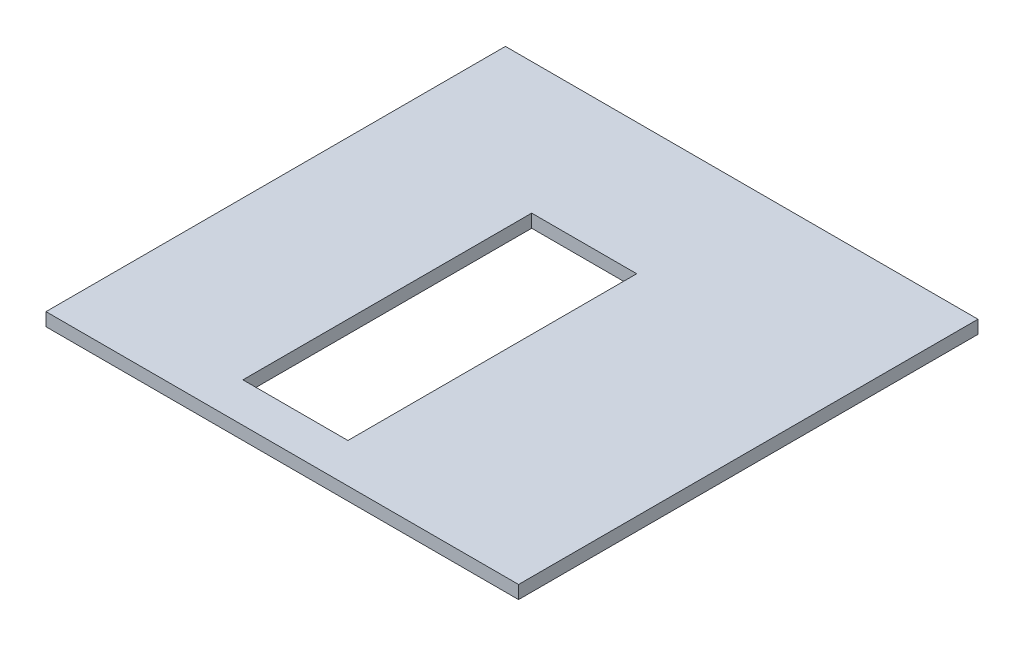
from build123d import *

# Parameters (mm, degrees)
SKETCH1_W           = 360
SKETCH1_H           = 350
SKETCH1_W_2         = 80
SKETCH1_H_2         = 220
BOSS_EXTRUDE1_DEPTH = 10


with BuildPart() as part:
    # Sketch1 → Boss-Extrude1 (new body)
    with BuildSketch(Plane(origin=(0, 0, 0), x_dir=(1, 0, 0), z_dir=(0, 1, 0))):
        Rectangle(SKETCH1_W, SKETCH1_H)
        with Locations((-20, -35)):
            Rectangle(SKETCH1_W_2, SKETCH1_H_2, mode=Mode.SUBTRACT)
    extrude(amount=BOSS_EXTRUDE1_DEPTH)


solid = part.part
